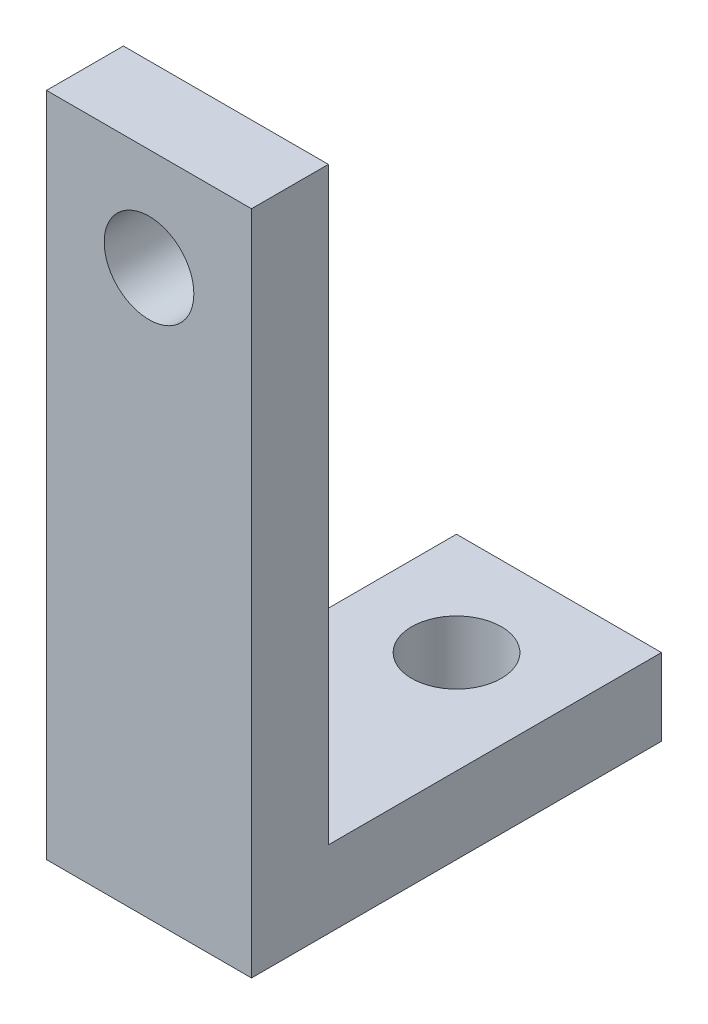
from build123d import *

# Parameters (mm, degrees)
SKETCH1_W           = 8
SKETCH1_H           = 26.000000001
BOSS_EXTRUDE1_DEPTH = 3
SKETCH2_W           = 8
SKETCH2_H           = 3
BOSS_EXTRUDE2_DEPTH = 13
SKETCH3_R           = 1.75
CUT_EXTRUDE1_DEPTH  = 8
SKETCH4_R           = 1.75
CUT_EXTRUDE2_DEPTH  = 8


with BuildPart() as part:
    # Sketch1 → Boss-Extrude1 (new body)
    with BuildSketch(Plane.XY):
        with Locations((-48.217529248, 7.15693313)):
            Rectangle(SKETCH1_W, SKETCH1_H)
    extrude(amount=BOSS_EXTRUDE1_DEPTH)

    # Sketch2 → Boss-Extrude2 (add)
    with BuildSketch(Plane(origin=(0, 0, 0), x_dir=(-1, 0, 0), z_dir=(0, 0, -1))):
        with Locations((48.217529248, -4.343066871)):
            Rectangle(SKETCH2_W, SKETCH2_H)
    extrude(amount=BOSS_EXTRUDE2_DEPTH)

    # Sketch3 → Cut-Extrude1 (cut)
    with BuildSketch(Plane(origin=(0, -5.843066871, 0), x_dir=(-1, 0, 0), z_dir=(0, -1, 0))):
        with Locations(Location((48.217529248, 9, 0), (0, 0, 90))):
            Circle(SKETCH3_R)
    extrude(amount=-CUT_EXTRUDE1_DEPTH, mode=Mode.SUBTRACT)

    # Sketch4 → Cut-Extrude2 (cut)
    with BuildSketch(Plane.XY.offset(3)):
        with Locations((-48.217529246, 16.156933129)):
            Circle(SKETCH4_R)
    extrude(amount=-CUT_EXTRUDE2_DEPTH, mode=Mode.SUBTRACT)


solid = part.part
